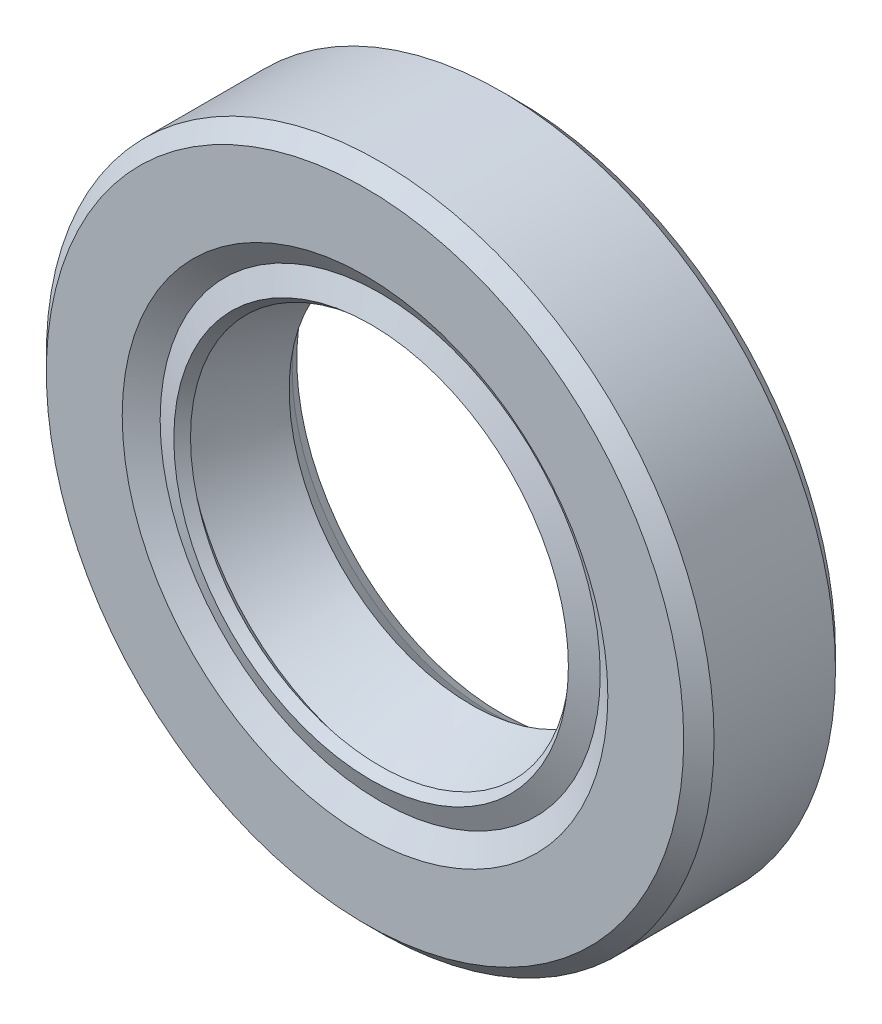
from build123d import *


with BuildPart() as part:
    # Esquisse1 → Révolution1 (revolve)
    with BuildSketch(Plane(origin=(0, 0, 0), x_dir=(0, 0, -1), z_dir=(1, 0, 0)), mode=Mode.PRIVATE) as r_volution1_sk:
        with BuildLine():
            Line((3.7367497, 7.3), (4.5, 7.1))
            Line((4.5, 7.1), (4.5, 6.75))
            Line((4.5, 6.75), (4.1, 6.5))
            Line((4.1, 6.5), (3.5, 6))
            Line((3.5, 6), (1.1, 7))
            Line((1.1, 7), (0.5, 6.25))
            Line((0.5, 6.25), (0.2, 6.5))
            Line((0.2, 6.5), (0.5, 7.25))
            Line((0.5, 7.25), (0, 8))
            Line((0, 8), (0, 10.5))
            Line((0, 10.5), (0.5, 11))
            Line((0.5, 11), (4.5, 11))
            Line((4.5, 11), (5, 10.5))
            Line((5, 10.5), (5, 10))
            Line((5, 10), (1, 10))
            Line((1, 10), (1, 8.6))
            Line((1, 8.6), (1.883484861, 8.05))
            ThreePointArc((1.883484861, 8.05), (3.175136454, 8.576969601), (3.7367497, 7.3))
        make_face()
    revolve(r_volution1_sk.sketch.rotate(Axis((0, 0, 0), (0, 0, -1)), 90), axis=Axis((0, 0, 0), (0, 0, -1)))


solid = part.part
